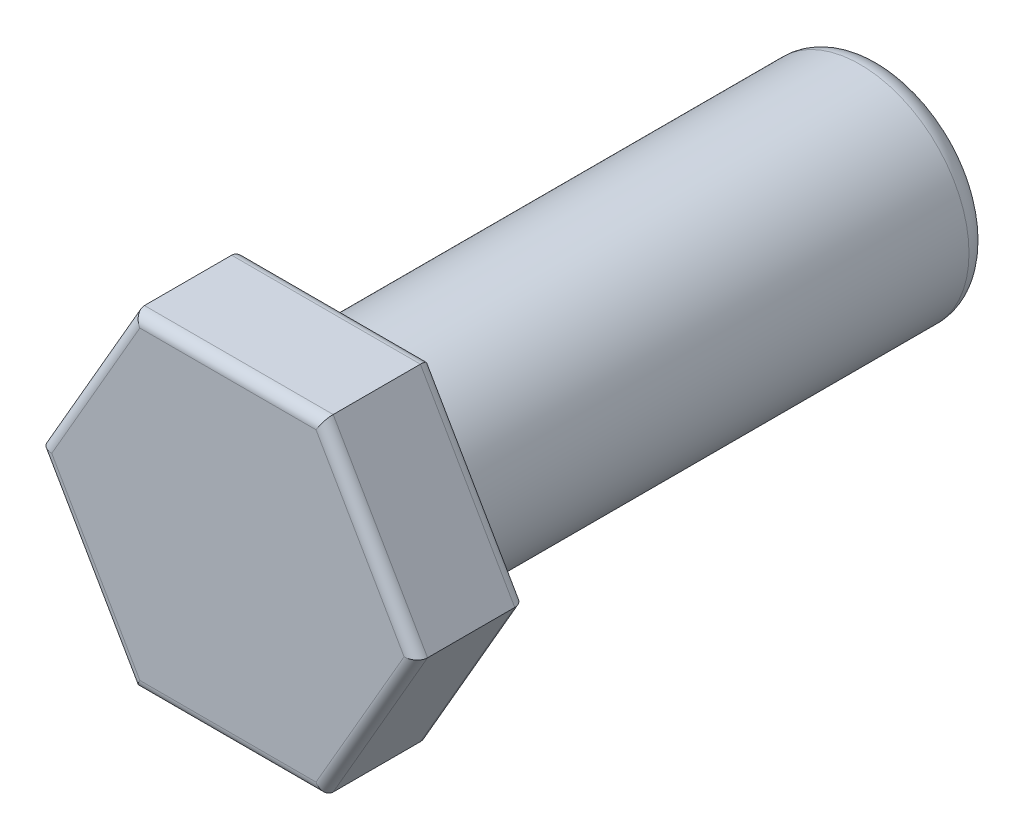
from build123d import *

# Parameters (mm, degrees)
SKETCH_1_R      = 5
EXTRUDE_1_DEPTH = 25
EXTRUDE_2_DEPTH = 5
FILLET_1_R      = 1
FILLET_2_R      = 0.5


with BuildPart() as part:
    # 草图1 → 凸台-拉伸1 (new body)
    with BuildSketch(Plane.XY):
        Circle(SKETCH_1_R)
    extrude(amount=EXTRUDE_1_DEPTH)

    # 草图2 → 凸台-拉伸2 (add)
    with BuildSketch(Plane.XY.offset(25)):
        Polygon((4.330127019, -7.5), (8.660254038, 0), (4.330127019, 7.5), (-4.330127019, 7.5), (-8.660254038, 0), (-4.330127019, -7.5), align=None)
    extrude(amount=EXTRUDE_2_DEPTH)

    # 圆角1
    fillet_1_edges = [part.edges().sort_by_distance(p)[0] for p in [
        (-5, 0, 0),
    ]]
    fillet(fillet_1_edges, radius=FILLET_1_R)

    # 圆角2
    fillet_2_edges = [part.edges().sort_by_distance(p)[0] for p in [
        (0, -7.5, 25),
        (6.495190528, -3.75, 25),
        (6.495190528, 3.75, 25),
        (0, 7.5, 25),
        (-6.495190528, 3.75, 25),
        (-6.495190528, -3.75, 25),
        (0, -7.5, 30),
        (6.495190528, -3.75, 30),
        (6.495190528, 3.75, 30),
        (0, 7.5, 30),
        (-6.495190528, 3.75, 30),
        (-6.495190528, -3.75, 30),
    ]]
    fillet(fillet_2_edges, radius=FILLET_2_R)


solid = part.part
